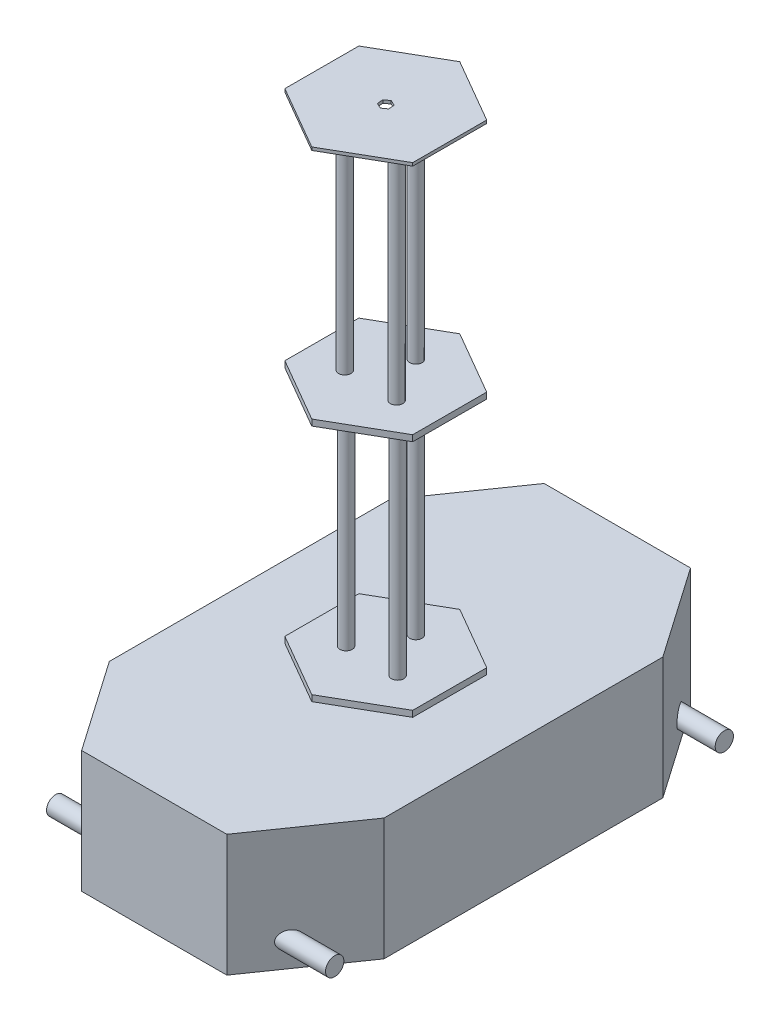
from build123d import *

# Parameters (mm, degrees)
BOSS_EXTRUDE1_DEPTH   = 200
BOSS_EXTRUDE2_DEPTH   = 10
SKETCH3_R             = 10.16
BOSS_EXTRUDE3_DEPTH   = 381.28
BOSS_EXTRUDE3_2_DEPTH = 381.28
BOSS_EXTRUDE3_3_DEPTH = 381.28
BOSS_EXTRUDE4_DEPTH   = 10
SKETCH6_R             = 10.16
BOSS_EXTRUDE5_DEPTH   = 381.28
BOSS_EXTRUDE6_DEPTH   = 5
BOSS_EXTRUDE9_START   = -457.4224
SKETCH11_R            = 15
BOSS_EXTRUDE9_DEPTH   = 457.4224


with BuildPart() as part:
    # Sketch1 → Boss-Extrude1 (new body)
    with BuildSketch(Plane(origin=(0, 0, 0), x_dir=(1, 0, 0), z_dir=(0, 1, 0))):
        Polygon((-1.483930898, -380.492285736), (-105.195130657, -231.420921496), (-105.195130657, 228.579078504), (-1.483930898, 377.650442745), (238.516069102, 377.650442745), (342.227268861, 228.579078504), (342.227268861, -228.579078504), (236.538956009, -380.492285736), align=None)
    extrude(amount=BOSS_EXTRUDE1_DEPTH)

    # Sketch2 → Boss-Extrude2 (add)
    with BuildSketch(Plane(origin=(0, 200, 0), x_dir=(1, 0, 0), z_dir=(0, 1, 0))):
        Polygon((117.863795573, -122.590474184), (222.878703994, -62.142525746), (223.036699251, 59.027026943), (118.179786085, 119.748631193), (13.164877663, 59.300682754), (13.006882407, -61.868869934), align=None)
    extrude(amount=BOSS_EXTRUDE2_DEPTH)

    # Sketch11 → Boss-Extrude9 (add)
    with BuildSketch(Plane(origin=(352.227268861, 0, 0), x_dir=(0, 0, -1), z_dir=(1, 0, 0)).offset(BOSS_EXTRUDE9_START)):
        with Locations((-319.379078504, 40)):
            Circle(SKETCH11_R)
    boss_extrude9 = extrude(amount=BOSS_EXTRUDE9_DEPTH)

    # Mirror6: Boss-Extrude9 across plane
    add(boss_extrude9.mirror(Plane.XY))


with BuildPart() as body_2:
    # Sketch3 → Boss-Extrude3 (new body)
    with BuildSketch(Plane(origin=(0, 210, 0), x_dir=(1, 0, 0), z_dir=(0, 1, 0))):
        with Locations(Location((118.179786085, 47.748631193, 0), (0, 0, 90))):
            Circle(SKETCH3_R)
    extrude(amount=BOSS_EXTRUDE3_DEPTH)


with BuildPart() as body_3:
    # Sketch3 → Boss-Extrude3 2 (new body)
    with BuildSketch(Plane(origin=(0, 210, 0), x_dir=(1, 0, 0), z_dir=(0, 1, 0))):
        with Locations(Location((160.651015276, -24.648777083, 0), (0, 0, 90))):
            Circle(SKETCH3_R)
    extrude(amount=BOSS_EXTRUDE3_2_DEPTH)


with BuildPart() as body_4:
    # Sketch3 → Boss-Extrude3 3 (new body)
    with BuildSketch(Plane(origin=(0, 210, 0), x_dir=(1, 0, 0), z_dir=(0, 1, 0))):
        with Locations(Location((76.717405945, -25.231236354, 0), (0, 0, 90))):
            Circle(SKETCH3_R)
    extrude(amount=BOSS_EXTRUDE3_3_DEPTH)


with BuildPart() as body_5:
    # Sketch4 → Boss-Extrude4 (new body)
    with BuildSketch(Plane(origin=(0, 591.28, 0), x_dir=(1, 0, 0), z_dir=(0, 1, 0))):
        Polygon((197.21545944, 46.136372217), (118.140988501, 89.994029365), (117.902593157, -92.835872356), (119.610781014, -93.783297188), (198.804449625, -46.226003475), align=None)
        Polygon((118.140988501, 89.994029365), (118.179786085, 119.748631193), (13.164877663, 59.300682754), (13.006882407, -61.868869934), (117.863795573, -122.590474184), (117.902593157, -92.835872356), (38.828122218, -48.978215208), (37.239132033, 43.384160484), (116.432800644, 90.941454197), align=None)
        Polygon((117.902593157, -92.835872356), (118.140988501, 89.994029365), (116.432800644, 90.941454197), (37.239132033, 43.384160484), (38.828122218, -48.978215208), align=None)
        Polygon((223.036699251, 59.027026943), (118.179786085, 119.748631193), (118.140988501, 89.994029365), (197.21545944, 46.136372217), (198.804449625, -46.226003475), (119.610781014, -93.783297188), (117.902593157, -92.835872356), (117.863795573, -122.590474184), (222.878703994, -62.142525746), align=None)
    extrude(amount=BOSS_EXTRUDE4_DEPTH)

    # Sketch6 → Boss-Extrude5 (add)
    with BuildSketch(Plane(origin=(0, 601.28, 0), x_dir=(1, 0, 0), z_dir=(0, 1, 0))):
        with Locations(Location((118.179786085, 47.748631193, 0), (0, 0, 90))):
            Circle(SKETCH6_R)
        with Locations(Location((160.524874922, -26.142525746, 0), (0, 0, 90))):
            Circle(SKETCH6_R)
        with Locations(Location((75.360711479, -25.868869934, 0), (0, 0, 90))):
            Circle(SKETCH6_R)
    extrude(amount=BOSS_EXTRUDE5_DEPTH)

    # Sketch7 → Boss-Extrude6 (add)
    with BuildSketch(Plane(origin=(0, 982.56, 0), x_dir=(1, 0, 0), z_dir=(0, 1, 0))):
        Polygon((109.485792495, -1.409791247), (38.021858837, -1.316608081), (37.961633459, -47.504590352), (117.901340073, -93.796886037), (118.009587888, -10.779587912), (110.000531921, -7.077133909), align=None)
        Polygon((118.03399377, 7.937744921), (118.142241584, 90.955043046), (38.082084215, 44.871374189), (38.021858837, -1.316608081), (109.485792495, -1.409791247), (109.112737735, 2.697586282), (117.133996643, 8.353798696), align=None)
        Polygon((118.142241584, 90.955043046), (118.179786085, 119.748631193), (13.164877663, 59.300682754), (13.085880035, -1.28409359), (38.021858837, -1.316608081), (38.082084215, 44.871374189), align=None)
        Polygon((38.021858837, -1.316608081), (13.085880035, -1.28409359), (13.006882407, -61.868869934), (117.863795573, -122.590474184), (117.901340073, -93.796886037), (37.961633459, -47.504590352), align=None)
        Polygon((197.961497443, -47.713217181), (198.021722821, -1.52523491), (126.557789163, -1.432051744), (126.930843922, -5.539429273), (118.909585014, -11.195641687), (118.009587888, -10.779587912), (117.901340073, -93.796886037), align=None)
        Polygon((222.878703994, -62.142525746), (222.957701623, -1.557749401), (198.021722821, -1.52523491), (197.961497443, -47.713217181), (117.901340073, -93.796886037), (117.863795573, -122.590474184), align=None)
        Polygon((198.081948198, 44.662747361), (118.142241584, 90.955043046), (118.03399377, 7.937744921), (126.043049736, 4.235290918), (126.557789163, -1.432051744), (198.021722821, -1.52523491), align=None)
        Polygon((223.036699251, 59.027026943), (118.179786085, 119.748631193), (118.142241584, 90.955043046), (198.081948198, 44.662747361), (198.021722821, -1.52523491), (222.957701623, -1.557749401), align=None)
    extrude(amount=BOSS_EXTRUDE6_DEPTH)


solid = Compound([part.part, body_2.part, body_3.part, body_4.part, body_5.part])
